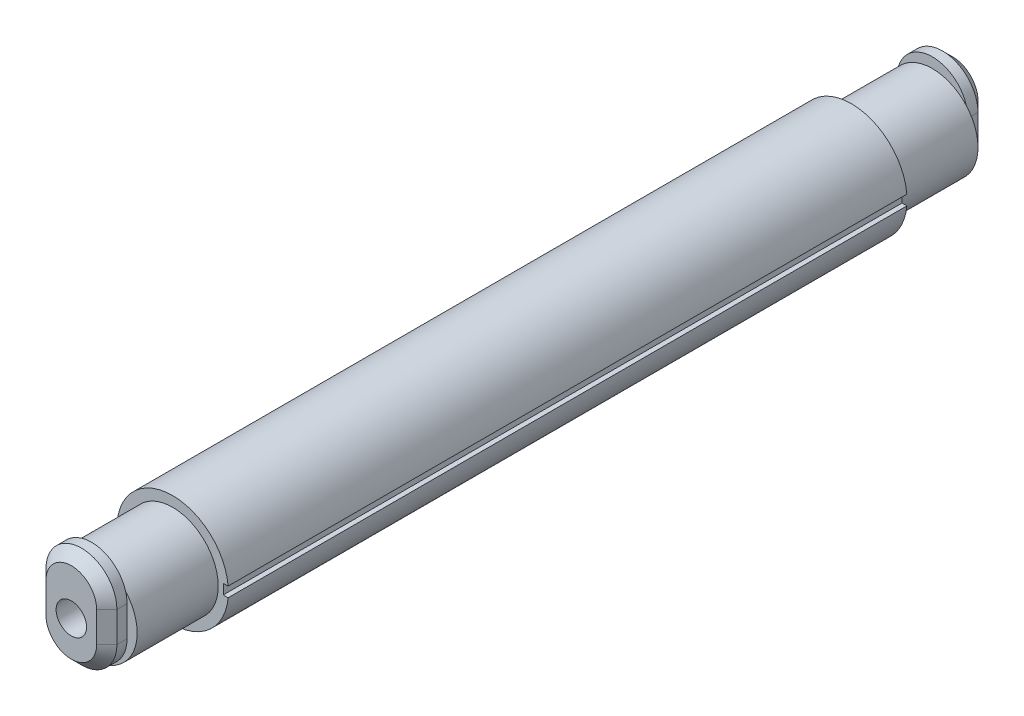
from build123d import *

# Parameters (mm, degrees)
SKETCH1_R                       = 5.5
BOSS_EXTRUDE1_DEPTH             = 67
SKETCH2_W                       = 1
SKETCH2_H                       = 1
CUT_EXTRUDE1_DEPTH              = 67
SKETCH3_R                       = 4.5
BOSS_EXTRUDE2_DEPTH             = 8
BOSS_EXTRUDE3_DEPTH             = 2
CHAMFER1_SIZE                   = 1
CHAMFER1_OF_MIRROR1_SIZE        = 1
F_3_0MM_DOWEL_HOLE1_D           = 3
F_3_0MM_DOWEL_HOLE1_CSINK_D     = 3.05
F_3_0MM_DOWEL_HOLE1_CSINK_ANGLE = 92


with BuildPart() as part:
    # Sketch1 → Boss-Extrude1 (new body)
    with BuildSketch(Plane.XY):
        Circle(SKETCH1_R)
    extrude(amount=BOSS_EXTRUDE1_DEPTH)

    # Sketch2 → Cut-Extrude1 (cut)
    with BuildSketch(Plane(origin=(0, 0, 0), x_dir=(-1, 0, 0), z_dir=(0, 0, -1))):
        with Locations((5.5, 0)):
            Rectangle(SKETCH2_W, SKETCH2_H)
        with Locations((-5.5, 0)):
            Rectangle(SKETCH2_W, SKETCH2_H)
    extrude(amount=-CUT_EXTRUDE1_DEPTH, mode=Mode.SUBTRACT)

    # Sketch3 → Boss-Extrude2 (add)
    with BuildSketch(Plane.XY.offset(67)):
        Circle(SKETCH3_R)
    boss_extrude2 = extrude(amount=BOSS_EXTRUDE2_DEPTH)

    # Sketch4 → Boss-Extrude3 (add)
    with BuildSketch(Plane.XY.offset(75)):
        with BuildLine():
            Line((-3.5, -0.992829401), (-3.5, 2.007170599))
            ThreePointArc((-3.5, 2.007170599), (0, 5.507170599), (3.5, 2.007170599))
            Line((3.5, 2.007170599), (3.5, -0.992829401))
            ThreePointArc((3.5, -0.992829401), (0, -4.492829401), (-3.5, -0.992829401))
        make_face()
    boss_extrude3 = extrude(amount=BOSS_EXTRUDE3_DEPTH)

    # Chamfer1
    chamfer1_edges = [part.edges().sort_by_distance(p)[0] for p in [
        (0, -4.492829401, 77),
        (3.5, 0.507170599, 77),
        (0, 5.507170599, 77),
        (-3.5, 0.507170599, 77),
    ]]
    chamfer(chamfer1_edges, length=CHAMFER1_SIZE)

    # Mirror1: Boss-Extrude2, Boss-Extrude3 across plane
    add(boss_extrude2.mirror(Plane.XY.offset(33.5)))
    add(boss_extrude3.mirror(Plane.XY.offset(33.5)))

    # Chamfer1 of Mirror1
    chamfer1_of_mirror1_edges = [part.edges().sort_by_distance(p)[0] for p in [
        (0, -4.492829401, -10),
        (3.5, 0.507170599, -10),
        (0, 5.507170599, -10),
        (-3.5, 0.507170599, -10),
    ]]
    chamfer(chamfer1_of_mirror1_edges, length=CHAMFER1_OF_MIRROR1_SIZE)

    # Ø3.0mm Dowel Hole1 (through all)
    with Locations(Plane(origin=(0, 0, -10), x_dir=(-1, 0, 0), z_dir=(0, 0, -1))):
        with Locations((0, 0)):
            CounterSinkHole(F_3_0MM_DOWEL_HOLE1_D / 2, F_3_0MM_DOWEL_HOLE1_CSINK_D / 2, counter_sink_angle=F_3_0MM_DOWEL_HOLE1_CSINK_ANGLE)


solid = part.part
